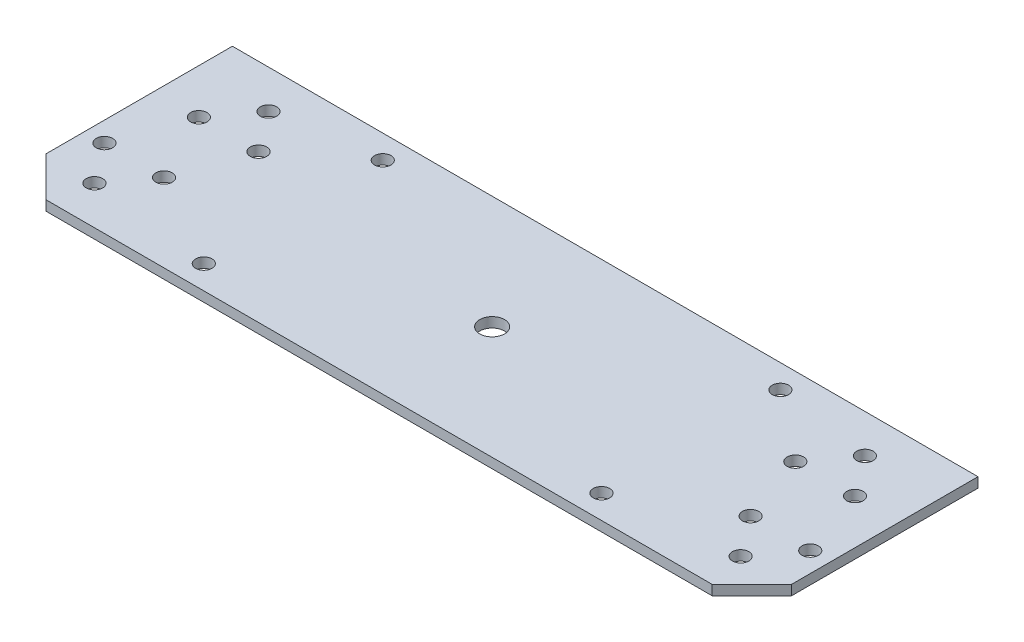
from build123d import *

# Parameters (mm, degrees)
SKETCH_1_W             = 150
SKETCH_1_H             = 45.5
EXTRUDE_1_DEPTH        = 2
CUT_EXTRUDE_1_REACH    = 80.4
SKETCH_2_R             = 1.65
CHAMFER_1_SIZE         = 8
CUT_EXTRUDE_1137_REACH = 80.4
SKETCH_3_R             = 2.5
CUT_EXTRUDE_2_REACH    = 80.4
SKETCH_4_R             = 1.65


with BuildPart() as part:
    # 草图1 → 凸台-拉伸1 (new body)
    with BuildSketch(Plane(origin=(0, 0, 0), x_dir=(1, 0, 0), z_dir=(0, 1, 0))):
        Rectangle(SKETCH_1_W, SKETCH_1_H)
    extrude(amount=EXTRUDE_1_DEPTH)

    # 草图2 → 切除-拉伸1 (cut, up to next)
    with BuildSketch(Plane(origin=(0, 2, 0), x_dir=(1, 0, 0), z_dir=(0, 1, 0)), mode=Mode.PRIVATE) as cut_extrude_1_sk1:
        with Locations(Location((-60, 15, 0), (0, 0, 270))):
            Circle(SKETCH_2_R)
    cut_extrude_1_tool1 = extrude(cut_extrude_1_sk1.sketch, amount=-CUT_EXTRUDE_1_REACH, mode=Mode.PRIVATE) & part.part
    # 草图2 → 切除-拉伸1 (cut, up to next)
    with BuildSketch(Plane(origin=(0, 2, 0), x_dir=(1, 0, 0), z_dir=(0, 1, 0)), mode=Mode.PRIVATE) as cut_extrude_1_sk2:
        with Locations(Location((-66, 7, 0), (0, 0, 270))):
            Circle(SKETCH_2_R)
    cut_extrude_1_tool2 = extrude(cut_extrude_1_sk2.sketch, amount=-CUT_EXTRUDE_1_REACH, mode=Mode.PRIVATE) & part.part
    # 草图2 → 切除-拉伸1 (cut, up to next)
    with BuildSketch(Plane(origin=(0, 2, 0), x_dir=(1, 0, 0), z_dir=(0, 1, 0)), mode=Mode.PRIVATE) as cut_extrude_1_sk3:
        with Locations(Location((-54, 7, 0), (0, 0, 270))):
            Circle(SKETCH_2_R)
    cut_extrude_1_tool3 = extrude(cut_extrude_1_sk3.sketch, amount=-CUT_EXTRUDE_1_REACH, mode=Mode.PRIVATE) & part.part
    # 草图2 → 切除-拉伸1 (cut, up to next)
    with BuildSketch(Plane(origin=(0, 2, 0), x_dir=(1, 0, 0), z_dir=(0, 1, 0)), mode=Mode.PRIVATE) as cut_extrude_1_sk4:
        with Locations(Location((-71, -7, 0), (0, 0, 270))):
            Circle(SKETCH_2_R)
    cut_extrude_1_tool4 = extrude(cut_extrude_1_sk4.sketch, amount=-CUT_EXTRUDE_1_REACH, mode=Mode.PRIVATE) & part.part
    # 草图2 → 切除-拉伸1 (cut, up to next)
    with BuildSketch(Plane(origin=(0, 2, 0), x_dir=(1, 0, 0), z_dir=(0, 1, 0)), mode=Mode.PRIVATE) as cut_extrude_1_sk5:
        with Locations(Location((-59, -7, 0), (0, 0, 270))):
            Circle(SKETCH_2_R)
    cut_extrude_1_tool5 = extrude(cut_extrude_1_sk5.sketch, amount=-CUT_EXTRUDE_1_REACH, mode=Mode.PRIVATE) & part.part
    # 草图2 → 切除-拉伸1 (cut, up to next)
    with BuildSketch(Plane(origin=(0, 2, 0), x_dir=(1, 0, 0), z_dir=(0, 1, 0)), mode=Mode.PRIVATE) as cut_extrude_1_sk6:
        with Locations(Location((-65, -15, 0), (0, 0, 270))):
            Circle(SKETCH_2_R)
    cut_extrude_1_tool6 = extrude(cut_extrude_1_sk6.sketch, amount=-CUT_EXTRUDE_1_REACH, mode=Mode.PRIVATE) & part.part
    cut_extrude_1_1 = cut_extrude_1_tool1.solids().sort_by_distance((-60, 2, -15))[0]
    add(cut_extrude_1_1, mode=Mode.SUBTRACT)
    cut_extrude_1_2 = cut_extrude_1_tool2.solids().sort_by_distance((-66, 2, -7))[0]
    add(cut_extrude_1_2, mode=Mode.SUBTRACT)
    cut_extrude_1_3 = cut_extrude_1_tool3.solids().sort_by_distance((-54, 2, -7))[0]
    add(cut_extrude_1_3, mode=Mode.SUBTRACT)
    cut_extrude_1_4 = cut_extrude_1_tool4.solids().sort_by_distance((-71, 2, 7))[0]
    add(cut_extrude_1_4, mode=Mode.SUBTRACT)
    cut_extrude_1_5 = cut_extrude_1_tool5.solids().sort_by_distance((-59, 2, 7))[0]
    add(cut_extrude_1_5, mode=Mode.SUBTRACT)
    cut_extrude_1_6 = cut_extrude_1_tool6.solids().sort_by_distance((-65, 2, 15))[0]
    add(cut_extrude_1_6, mode=Mode.SUBTRACT)
    cut_extrude_1 = cut_extrude_1_1 + cut_extrude_1_2 + cut_extrude_1_3 + cut_extrude_1_4 + cut_extrude_1_5 + cut_extrude_1_6  # 切除-拉伸1 as one shape, for the pattern or mirror that repeats it

    # 镜向1: 切除-拉伸1 across plane
    add(cut_extrude_1.mirror(Plane(origin=(0, 0, 0), x_dir=(0, 0, 1), z_dir=(1, 0, 0))), mode=Mode.SUBTRACT)

    # 倒角1
    chamfer_1_edges = [part.edges().sort_by_distance(p)[0] for p in [
        (75, 1, 22.75),
        (-75, 1, 22.75),
    ]]
    chamfer(chamfer_1_edges, length=CHAMFER_1_SIZE)

    # 草图3 → Cut-Extrude 1137 (cut, up to next)
    with BuildSketch(Plane(origin=(0, 2, 0), x_dir=(1, 0, 0), z_dir=(0, 1, 0)), mode=Mode.PRIVATE) as cut_extrude_1137_sk1:
        with Locations(Location((0, 0, 0), (0, 0, 270))):
            Circle(SKETCH_3_R)
    cut_extrude_1137_tool1 = extrude(cut_extrude_1137_sk1.sketch, amount=-CUT_EXTRUDE_1137_REACH, mode=Mode.PRIVATE) & part.part
    add(cut_extrude_1137_tool1.solids().sort_by_distance((0, 2, 0))[0], mode=Mode.SUBTRACT)

    # 草图4 → 切除-拉伸2 (cut, up to next)
    with BuildSketch(Plane(origin=(0, 2, 0), x_dir=(1, 0, 0), z_dir=(0, 1, 0)), mode=Mode.PRIVATE) as cut_extrude_2_sk1:
        with Locations(Location((-40, 18, 0), (0, 0, 270))):
            Circle(SKETCH_4_R)
    cut_extrude_2_tool1 = extrude(cut_extrude_2_sk1.sketch, amount=-CUT_EXTRUDE_2_REACH, mode=Mode.PRIVATE) & part.part
    # 草图4 → 切除-拉伸2 (cut, up to next)
    with BuildSketch(Plane(origin=(0, 2, 0), x_dir=(1, 0, 0), z_dir=(0, 1, 0)), mode=Mode.PRIVATE) as cut_extrude_2_sk2:
        with Locations(Location((-40, -18, 0), (0, 0, 270))):
            Circle(SKETCH_4_R)
    cut_extrude_2_tool2 = extrude(cut_extrude_2_sk2.sketch, amount=-CUT_EXTRUDE_2_REACH, mode=Mode.PRIVATE) & part.part
    # 草图4 → 切除-拉伸2 (cut, up to next)
    with BuildSketch(Plane(origin=(0, 2, 0), x_dir=(1, 0, 0), z_dir=(0, 1, 0)), mode=Mode.PRIVATE) as cut_extrude_2_sk3:
        with Locations(Location((40, 18, 0), (0, 0, 270))):
            Circle(SKETCH_4_R)
    cut_extrude_2_tool3 = extrude(cut_extrude_2_sk3.sketch, amount=-CUT_EXTRUDE_2_REACH, mode=Mode.PRIVATE) & part.part
    # 草图4 → 切除-拉伸2 (cut, up to next)
    with BuildSketch(Plane(origin=(0, 2, 0), x_dir=(1, 0, 0), z_dir=(0, 1, 0)), mode=Mode.PRIVATE) as cut_extrude_2_sk4:
        with Locations(Location((40, -18, 0), (0, 0, 270))):
            Circle(SKETCH_4_R)
    cut_extrude_2_tool4 = extrude(cut_extrude_2_sk4.sketch, amount=-CUT_EXTRUDE_2_REACH, mode=Mode.PRIVATE) & part.part
    add(cut_extrude_2_tool1.solids().sort_by_distance((-40, 2, -18))[0], mode=Mode.SUBTRACT)
    add(cut_extrude_2_tool2.solids().sort_by_distance((-40, 2, 18))[0], mode=Mode.SUBTRACT)
    add(cut_extrude_2_tool3.solids().sort_by_distance((40, 2, -18))[0], mode=Mode.SUBTRACT)
    add(cut_extrude_2_tool4.solids().sort_by_distance((40, 2, 18))[0], mode=Mode.SUBTRACT)


solid = part.part
